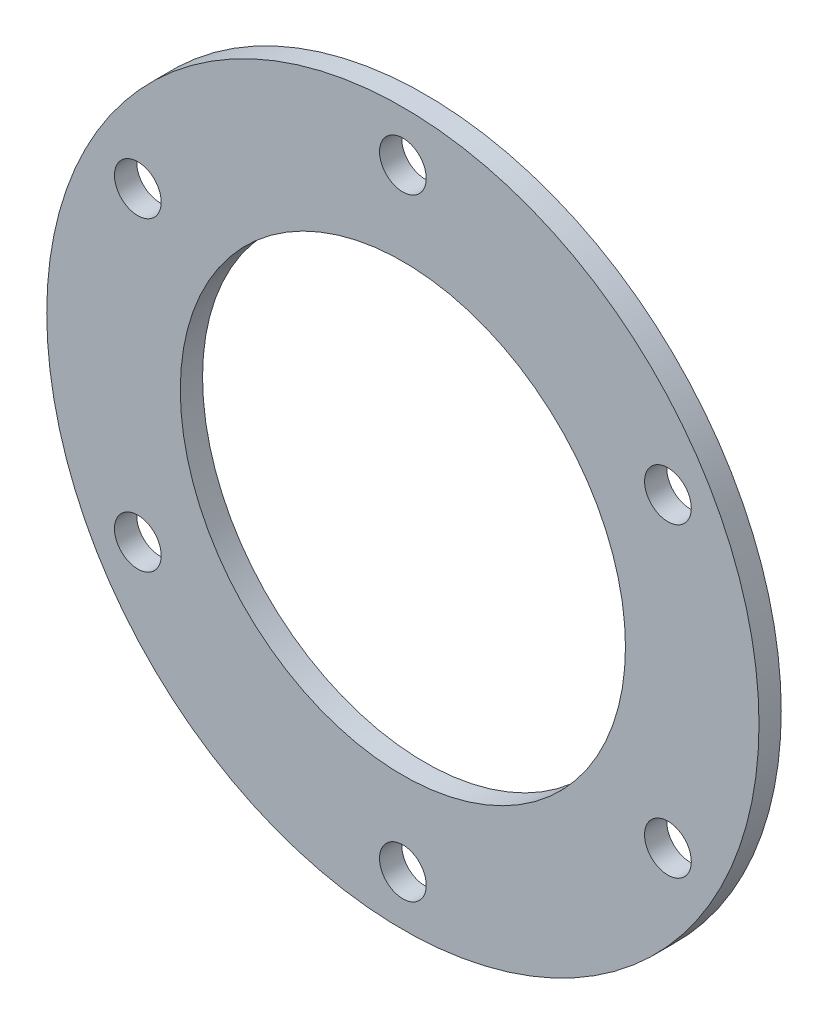
from build123d import *

# Parameters (mm, degrees)
SKETCH_1_R               = 32
SKETCH_1_R_2             = 20
EXTRUDE_1_DEPTH          = 2
HOLE_WIZARD_M41_D        = 4.2
PATTERN_CIRCULAR_1_COUNT = 6


with BuildPart() as part:
    # Эскиз1 → Бобышка-Вытянуть1 (new body)
    with BuildSketch(Plane.XY):
        Circle(SKETCH_1_R)
        Circle(SKETCH_1_R_2, mode=Mode.SUBTRACT)
    extrude(amount=EXTRUDE_1_DEPTH)

    # Сверло под метчик  спиральное M41 (through all)
    with Locations(Plane.XY.offset(2)):
        with Locations((0, 27.5)):
            hole_wizard_m41 = Hole(HOLE_WIZARD_M41_D / 2)

    # Круговой массив1: Сверло под метчик  спиральное M41 ×6 about axis
    pattern_circular_1_axis = Axis((0, 0, 0), (0, 0, 1))
    for i in range(1, PATTERN_CIRCULAR_1_COUNT):
        add(hole_wizard_m41.rotate(pattern_circular_1_axis, i * 360 / PATTERN_CIRCULAR_1_COUNT), mode=Mode.SUBTRACT)


solid = part.part
